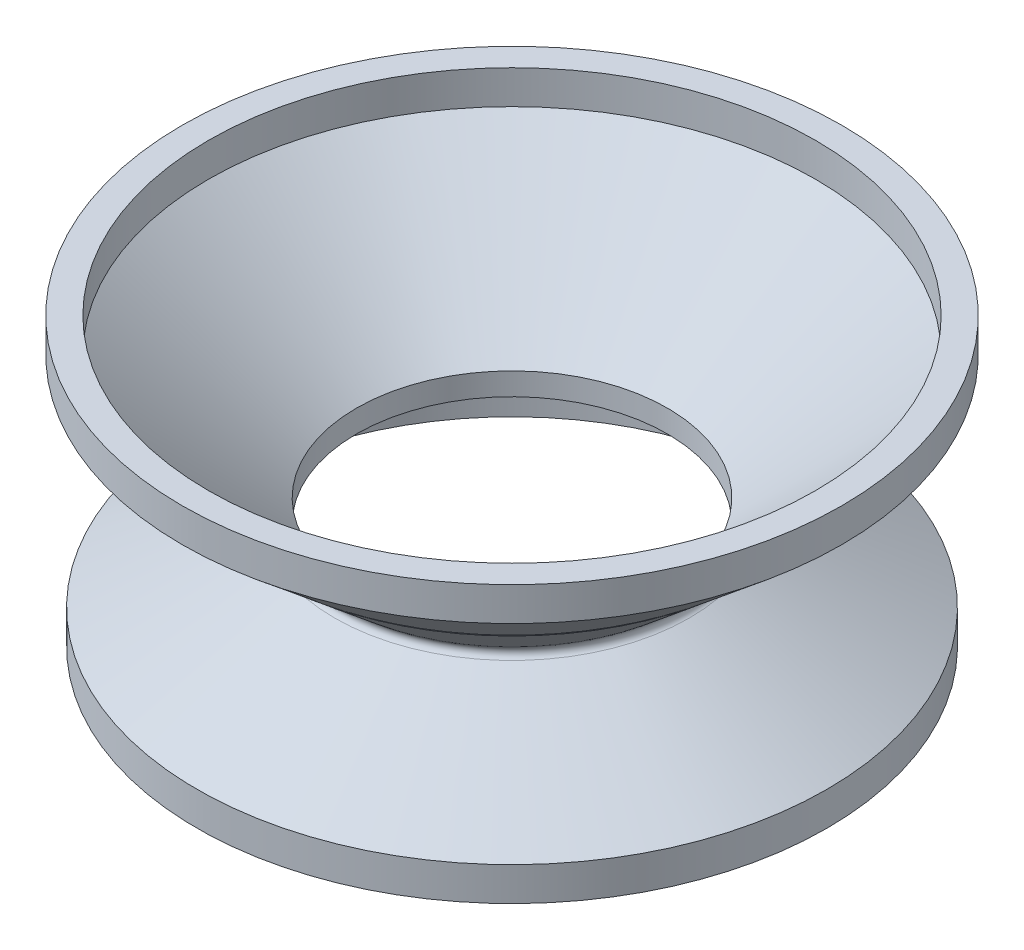
from build123d import *

# Parameters (mm, degrees)
FILLET2_R           = 0.4
SKETCH2_R           = 19.555723827
SKETCH2_R_2         = 18
BOSS_EXTRUDE1_DEPTH = 2
SKETCH3_R           = 18.681949124
SKETCH3_R_2         = 16.681949124
BOSS_EXTRUDE2_DEPTH = 2


with BuildPart() as part:
    # Sketch1 → Revolve1 (revolve)
    with BuildSketch(Plane.XY):
        Polygon((0.662781953, 0), (-4.026073282, 3.934416698), (-4.026073282, 4.195498156), (-4.337218047, 4.195498156), (-8.871246788, 8), (-7.315522961, 8), (1.462781953, 0.634127584), (1.462781953, -0.692820323), (-5.997472085, -5), (-7.997472085, -5), align=None)
    revolve(axis=Axis((10.684477039, 7.609018033, 0), (0, -1, 0)))

    # Fillet2
    fillet2_edges = [part.edges().sort_by_distance(p)[0] for p in [
        (20.706172125, 0, 0),
    ]]
    fillet(fillet2_edges, radius=FILLET2_R)

    # Sketch2 → Boss-Extrude1 (add)
    with BuildSketch(Plane(origin=(0, 8, 0), x_dir=(1, 0, 0), z_dir=(0, 1, 0))):
        with Locations(Location((10.684477039, 0, 0), (0, 0, 180))):
            Circle(SKETCH2_R)
        with Locations(Location((10.684477039, 0, 0), (0, 0, 180))):
            Circle(SKETCH2_R_2, mode=Mode.SUBTRACT)
    extrude(amount=BOSS_EXTRUDE1_DEPTH)

    # Sketch3 → Boss-Extrude2 (add)
    with BuildSketch(Plane.XZ.offset(5)):
        with Locations((10.684477039, 0)):
            Circle(SKETCH3_R)
        with Locations(Location((10.684477039, 0, 0), (0, 0, 180))):
            Circle(SKETCH3_R_2, mode=Mode.SUBTRACT)
    extrude(amount=BOSS_EXTRUDE2_DEPTH)


solid = part.part
